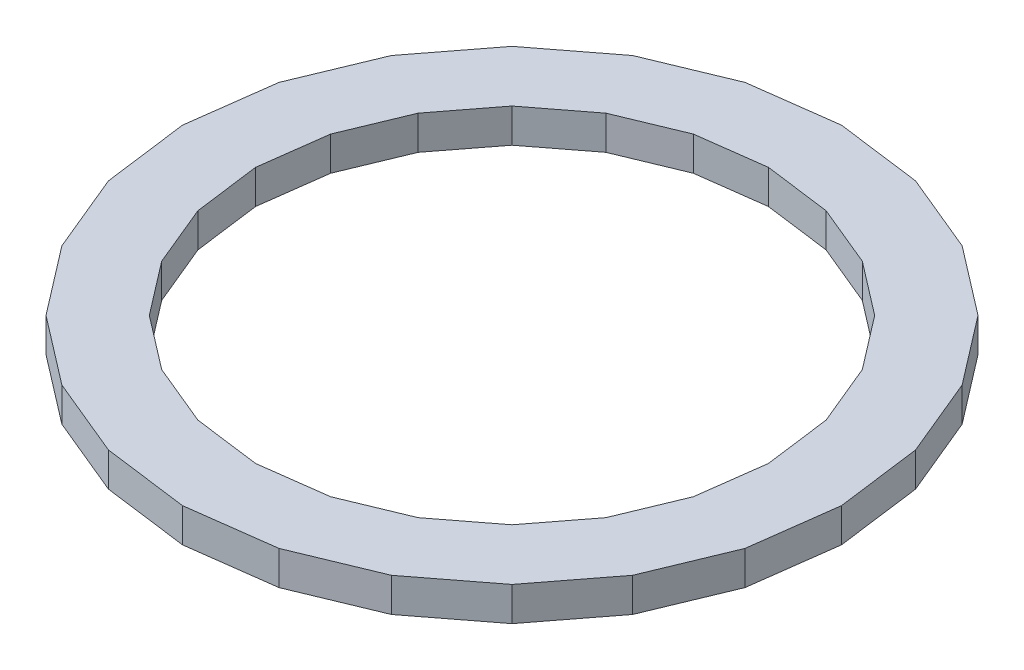
from build123d import *

# Parameters (mm, degrees)
BOSS_EXTRUDE2_DEPTH = 19.05


with BuildPart() as part:
    # Sketch2 → Boss-Extrude2 (new body)
    with BuildSketch(Plane(origin=(0, 0, 0), x_dir=(1, 0, 0), z_dir=(0, 1, 0))):
        Polygon((-184.867110498, 0), (-178.567916461, -47.84712901), (-160.099614015, -92.433555249), (-130.720787451, -130.720787451), (-92.433555249, -160.099614015), (-47.84712901, -178.567916461), (0, -184.867110498), (47.84712901, -178.567916461), (92.433555249, -160.099614015), (130.720787451, -130.720787451), (160.099614015, -92.433555249), (178.567916461, -47.84712901), (184.867110498, 0), (178.567916461, 47.84712901), (160.099614015, 92.433555249), (130.720787451, 130.720787451), (92.433555249, 160.099614015), (47.84712901, 178.567916461), (0, 184.867110498), (-47.84712901, 178.567916461), (-92.433555249, 160.099614015), (-130.720787451, 130.720787451), (-160.099614015, 92.433555249), (-178.567916461, 47.84712901), align=None)
        Polygon((-143.87642954, 0), (-138.973959087, -37.237960106), (-124.600642987, -71.93821477), (-101.735998981, -101.735998981), (-71.93821477, -124.600642987), (-37.237960106, -138.973959087), (0, -143.87642954), (37.237960106, -138.973959087), (71.93821477, -124.600642987), (101.735998981, -101.735998981), (124.600642987, -71.93821477), (138.973959087, -37.237960106), (143.87642954, 0), (138.973959087, 37.237960106), (124.600642987, 71.93821477), (101.735998981, 101.735998981), (71.93821477, 124.600642987), (37.237960106, 138.973959087), (0, 143.87642954), (-37.237960106, 138.973959087), (-71.93821477, 124.600642987), (-101.735998981, 101.735998981), (-124.600642987, 71.93821477), (-138.973959087, 37.237960106), align=None, mode=Mode.SUBTRACT)
    extrude(amount=BOSS_EXTRUDE2_DEPTH)


solid = part.part
